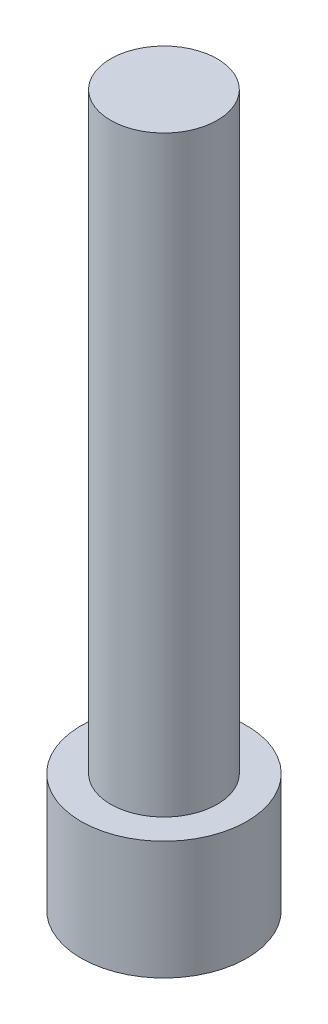
from build123d import *

# Parameters (mm, degrees)
SZKIC1_R                    = 7
DODANIE_WYCI_GNI_CIE1_DEPTH = 10
SZKIC2_R                    = 4.5
DODANIE_WYCI_GNI_CIE2_DEPTH = 50
WYTNIJ_WYCI_GNI_CIE1_DEPTH  = 5


with BuildPart() as part:
    # Szkic1 → Dodanie-wyciągnięcie1 (new body)
    with BuildSketch(Plane(origin=(0, 0, 0), x_dir=(1, 0, 0), z_dir=(0, 1, 0))):
        with Locations(Location((0, 0, 0), (0, 0, 270))):
            Circle(SZKIC1_R)
    extrude(amount=DODANIE_WYCI_GNI_CIE1_DEPTH)

    # Szkic2 → Dodanie-wyciągnięcie2 (add)
    with BuildSketch(Plane(origin=(0, 10, 0), x_dir=(1, 0, 0), z_dir=(0, 1, 0))):
        with Locations(Location((0, 0, 0), (0, 0, 270))):
            Circle(SZKIC2_R)
    extrude(amount=DODANIE_WYCI_GNI_CIE2_DEPTH)

    # Szkic3 → Wytnij-wyciągnięcie1 (cut)
    with BuildSketch(Plane.XZ):
        Polygon((0, -3.464101615), (3, -1.732050808), (3, 1.732050808), (0, 3.464101615), (-3, 1.732050808), (-3, -1.732050808), align=None)
    extrude(amount=-WYTNIJ_WYCI_GNI_CIE1_DEPTH, mode=Mode.SUBTRACT)


solid = part.part
